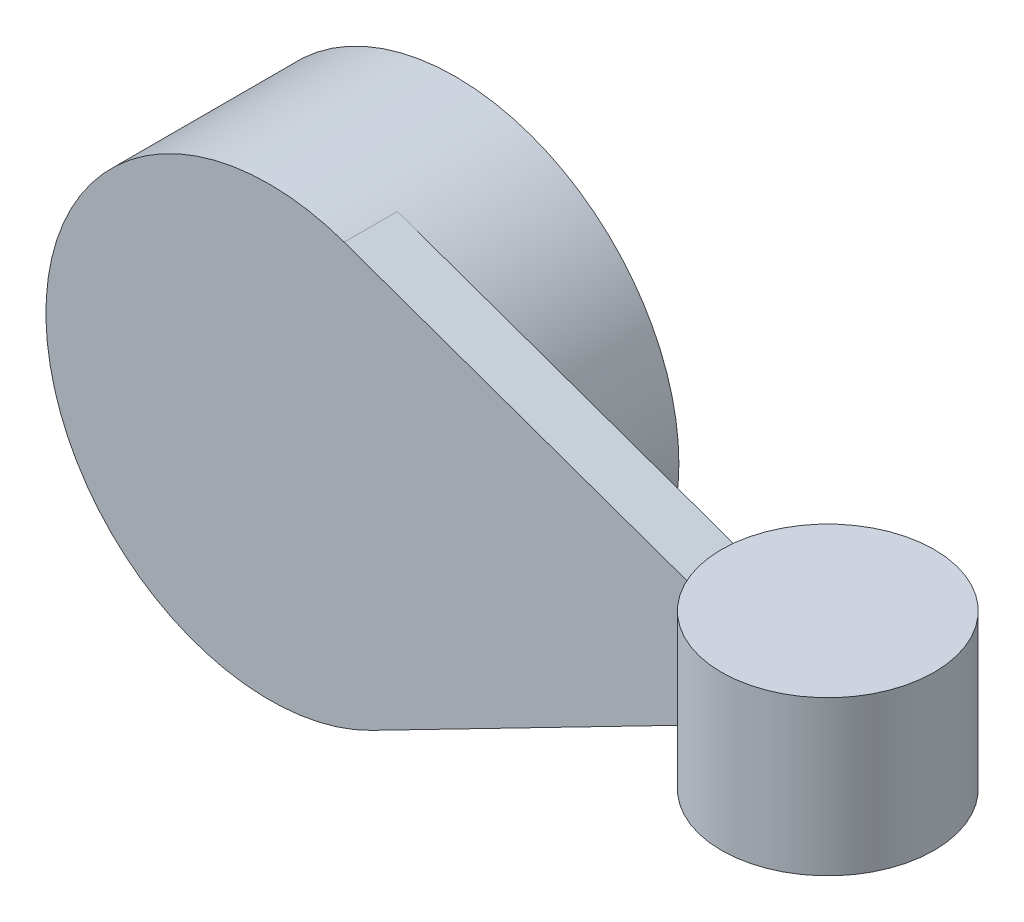
from build123d import *

# Parameters (mm, degrees)
SKETCH_1_R      = 42
EXTRUDE_1_DEPTH = 30
EXTRUDE_2_DEPTH = 5


with BuildPart() as part:
    # 草图1 → 凸台-拉伸1 (new body)
    with BuildSketch(Plane.XY):
        Circle(SKETCH_1_R)
    extrude(amount=EXTRUDE_1_DEPTH)



with BuildPart() as body_2:
    # 草图2 → 旋转1 (revolve)
    with BuildSketch(Plane.XY.offset(30), mode=Mode.PRIVATE) as revolve_1_sk:
        with BuildLine():
            Line((100, 20), (100, 15))
            ThreePointArc((100, 15), (86.583592135, 6.708203932), (88, -9))
            Line((88, -9), (80, -9))
            Line((80, -9), (80, 20))
            Line((80, 20), (100, 20))
        make_face()
    revolve(revolve_1_sk.sketch.rotate(Axis((100, 22.717290725, 30), (0, -1, 0)), 270), axis=Axis((100, 22.717290725, 30), (0, -1, 0)))


with BuildPart() as part_1:
    add(part.part)

    add(body_2.part)  # 凸台-拉伸2 merges body 2
    # 草图3 → 凸台-拉伸2 (add, symmetric)
    with BuildSketch(Plane.XY.offset(30)):
        with BuildLine():
            Line((14.069453744, 39.573355574), (86, 14))
            Line((86, 14), (86, -3))
            Line((86, -3), (19.208719722, -37.350034627))
            ThreePointArc((19.208719722, -37.350034627), (-41.906577017, -2.79978619), (14.069453744, 39.573355574))
        make_face()
    extrude(amount=EXTRUDE_2_DEPTH, both=True)


solid = part_1.part
